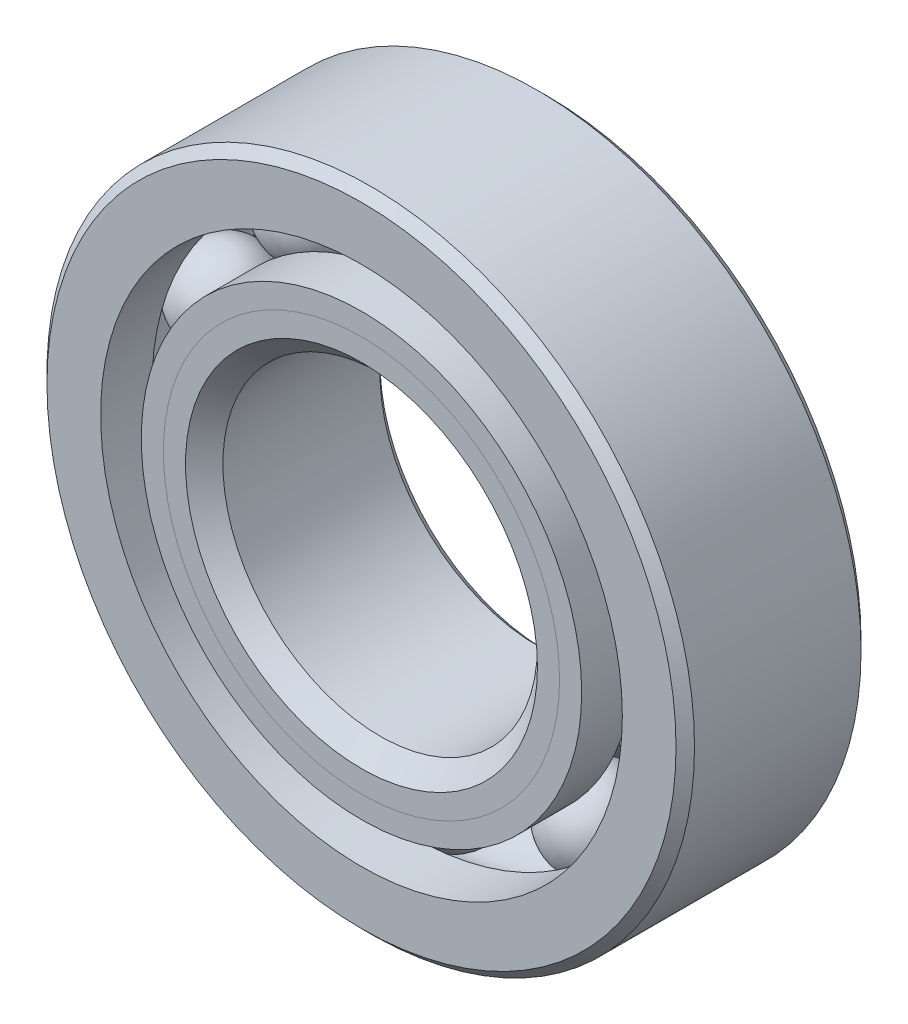
from build123d import *

# Parameters (mm, degrees)
CIRPATTERN1_COUNT = 10


with BuildPart() as part:
    # Sketch1 → Revolve1 (revolve)
    with BuildSketch(Plane(origin=(0, 0, 0), x_dir=(0, 0, -1), z_dir=(1, 0, 0))):
        with BuildLine():
            Line((4.5, 17.5), (-4.5, 17.5))
            Line((-4.5, 17.5), (-5, 17))
            Line((-5, 17), (-5, 14.098901099))
            Line((-5, 14.098901099), (-2.222222222, 14.098901099))
            ThreePointArc((-2.222222222, 14.098901099), (0, 15.479083546), (2.222222222, 14.098901099))
            Line((2.222222222, 14.098901099), (5, 14.098901099))
            Line((5, 14.098901099), (5, 17))
            Line((5, 17), (4.5, 17.5))
        make_face()
    revolve(axis=Axis((0, 0, 5), (0, 0, -1)))


with BuildPart() as body_2:
    # Sketch2 → Revolve2 (revolve)
    with BuildSketch(Plane(origin=(0, 0, 0), x_dir=(0, 0, -1), z_dir=(1, 0, 0))):
        with BuildLine():
            Line((-5, 11.901098901), (-2.222222222, 11.901098901))
            ThreePointArc((-2.222222222, 11.901098901), (-1.307973164, 10.894041446), (0, 10.520916454))
            Line((0, 10.520916454), (0, 9.510458227))
            Line((0, 9.510458227), (-3.804679663, 9.510458227))
            Line((-3.804679663, 9.510458227), (-5, 10.705778564))
            Line((-5, 10.705778564), (-5, 11.901098901))
        make_face()
    revolve(axis=Axis((0, 0, 5), (0, 0, -1)))


with BuildPart() as body_3:
    # Sketch3 → Revolve3 (revolve)
    with BuildSketch(Plane(origin=(0, 0, 0), x_dir=(0, 0, -1), z_dir=(1, 0, 0))):
        with BuildLine():
            Line((-5, 10.705778564), (-3.804679663, 9.510458227))
            Line((-3.804679663, 9.510458227), (0, 9.510458227))
            Line((0, 9.510458227), (0, 10.520916454))
            ThreePointArc((0, 10.520916454), (1.307973164, 10.894041446), (2.222222222, 11.901098901))
            Line((2.222222222, 11.901098901), (5, 11.901098901))
            Line((5, 11.901098901), (5, 9))
            Line((5, 9), (4.5, 8.5))
            Line((4.5, 8.5), (-3.989541773, 8.5))
            Line((-3.989541773, 8.5), (-5, 9.510458227))
            Line((-5, 9.510458227), (-5, 10.705778564))
        make_face()
    revolve(axis=Axis((0, 0, 5), (0, 0, -1)))


with BuildPart() as body_4:
    # Sketch4 → Revolve4 (revolve)
    with BuildSketch(Plane(origin=(0, 0, 0), x_dir=(0, 0, -1), z_dir=(1, 0, 0))):
        with BuildLine():
            Line((-2.479083546, 13), (2.479083546, 13))
            ThreePointArc((2.479083546, 13), (0, 15.479083546), (-2.479083546, 13))
        make_face()
    revolve(axis=Axis((0, 13, 2.479083546), (0, 0, -1)))


with BuildPart() as cirpattern1_1:
    # CirPattern1: pattern copy
    add(body_4.part.rotate(Axis((0, 0, -5), (0, 0, 1)), 1 * 360 / CIRPATTERN1_COUNT))


with BuildPart() as cirpattern1_2:
    # CirPattern1: pattern copy
    add(body_4.part.rotate(Axis((0, 0, -5), (0, 0, 1)), 2 * 360 / CIRPATTERN1_COUNT))


with BuildPart() as cirpattern1_3:
    # CirPattern1: pattern copy
    add(body_4.part.rotate(Axis((0, 0, -5), (0, 0, 1)), 3 * 360 / CIRPATTERN1_COUNT))


with BuildPart() as cirpattern1_4:
    # CirPattern1: pattern copy
    add(body_4.part.rotate(Axis((0, 0, -5), (0, 0, 1)), 4 * 360 / CIRPATTERN1_COUNT))


with BuildPart() as cirpattern1_5:
    # CirPattern1: pattern copy
    add(body_4.part.rotate(Axis((0, 0, -5), (0, 0, 1)), 5 * 360 / CIRPATTERN1_COUNT))


with BuildPart() as cirpattern1_6:
    # CirPattern1: pattern copy
    add(body_4.part.rotate(Axis((0, 0, -5), (0, 0, 1)), 6 * 360 / CIRPATTERN1_COUNT))


with BuildPart() as cirpattern1_7:
    # CirPattern1: pattern copy
    add(body_4.part.rotate(Axis((0, 0, -5), (0, 0, 1)), 7 * 360 / CIRPATTERN1_COUNT))


with BuildPart() as cirpattern1_8:
    # CirPattern1: pattern copy
    add(body_4.part.rotate(Axis((0, 0, -5), (0, 0, 1)), 8 * 360 / CIRPATTERN1_COUNT))


with BuildPart() as cirpattern1_9:
    # CirPattern1: pattern copy
    add(body_4.part.rotate(Axis((0, 0, -5), (0, 0, 1)), 9 * 360 / CIRPATTERN1_COUNT))


solid = Compound([part.part, body_2.part, body_3.part, body_4.part, cirpattern1_1.part, cirpattern1_2.part, cirpattern1_3.part, cirpattern1_4.part, cirpattern1_5.part, cirpattern1_6.part, cirpattern1_7.part, cirpattern1_8.part, cirpattern1_9.part])
